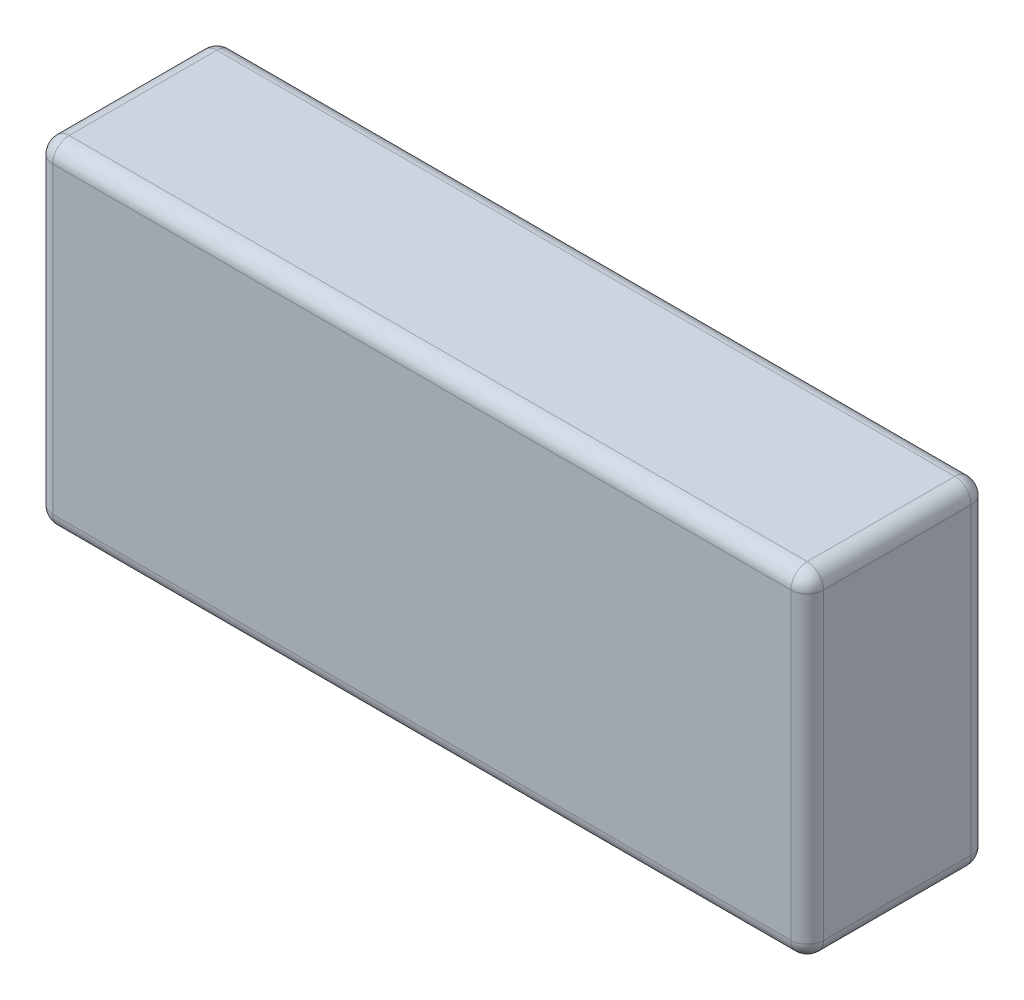
from build123d import *

# Parameters (mm, degrees)
SKETCH_1_W      = 94
SKETCH_1_H      = 41
EXTRUDE_1_DEPTH = 22
FILLET_1_R      = 2


with BuildPart() as part:
    # 草图1 → 凸台-拉伸1 (new body)
    with BuildSketch(Plane.XY):
        with Locations((-14.063226831, 7.013157895)):
            Rectangle(SKETCH_1_W, SKETCH_1_H)
    extrude(amount=EXTRUDE_1_DEPTH)

    # 圆角1
    fillet_1_edges = [part.edges().sort_by_distance(p)[0] for p in [
        (-61.063226831, 7.013157895, 22),
        (-14.063226831, -13.486842105, 22),
        (32.936773169, 7.013157895, 22),
        (-14.063226831, -13.486842105, 0),
        (-61.063226831, 7.013157895, 0),
        (-14.063226831, 27.513157895, 0),
        (32.936773169, 7.013157895, 0),
        (-14.063226831, 27.513157895, 22),
        (32.936773169, -13.486842105, 11),
        (-61.063226831, -13.486842105, 11),
        (-61.063226831, 27.513157895, 11),
        (32.936773169, 27.513157895, 11),
    ]]
    fillet(fillet_1_edges, radius=FILLET_1_R)


solid = part.part
